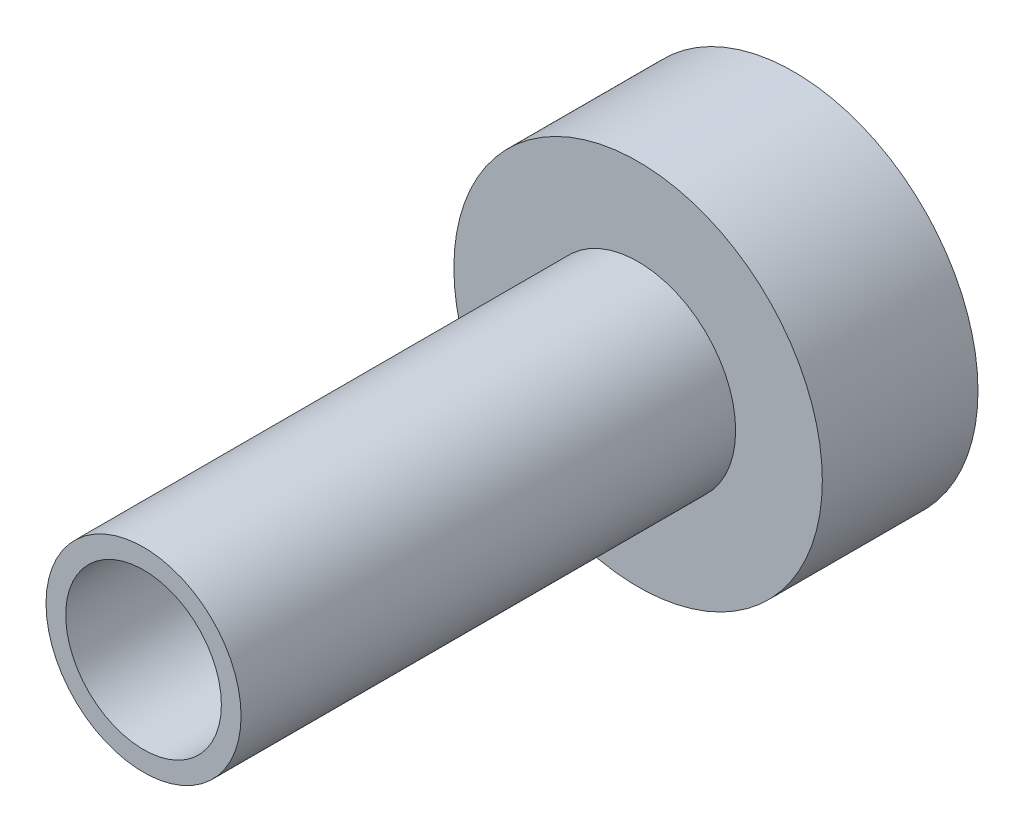
from build123d import *

# Parameters (mm, degrees)
SKETCH1_R           = 9.35
SKETCH1_R_2         = 3.95
BOSS_EXTRUDE1_DEPTH = 33
CUT_EXTRUDE1_START  = -25.1
SKETCH2_R           = 9.35
SKETCH2_R_2         = 4.95
CUT_EXTRUDE1_DEPTH  = 25.1


with BuildPart() as part:
    # Sketch1 → Boss-Extrude1 (new body)
    with BuildSketch(Plane.XY):
        Circle(SKETCH1_R)
        Circle(SKETCH1_R_2, mode=Mode.SUBTRACT)
    extrude(amount=BOSS_EXTRUDE1_DEPTH)

    # Sketch2 → Cut-Extrude1 (cut)
    with BuildSketch(Plane.XY.offset(33).offset(CUT_EXTRUDE1_START)):
        Circle(SKETCH2_R)
        Circle(SKETCH2_R_2, mode=Mode.SUBTRACT)
    extrude(amount=CUT_EXTRUDE1_DEPTH, mode=Mode.SUBTRACT)


solid = part.part
